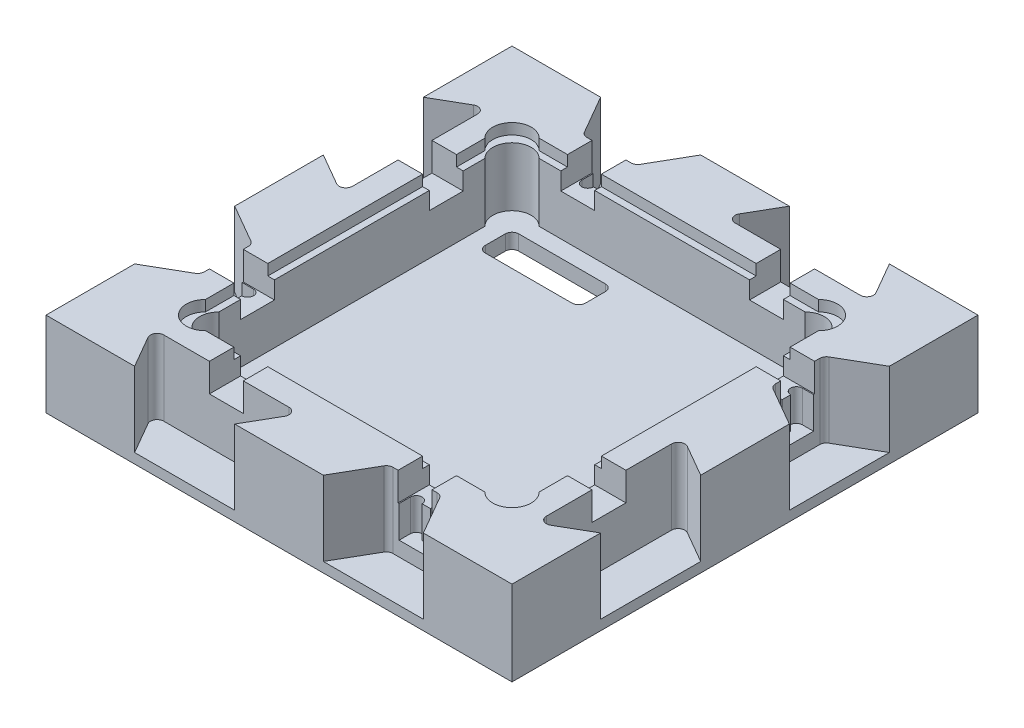
from build123d import *

# Parameters (mm, degrees)
SKETCH1_W                          = 139.7
SKETCH1_H                          = 139.7
BOSS_EXTRUDE1_DEPTH                = 12.7
POWER_SUPPLY_COMPONENT_DEPTH_DEPTH = 20.9
CUT_EXTRUDE6_DEPTH                 = 22.4
SKETCH8_W                          = 10.16
SKETCH8_H                          = 9.35
CUT_EXTRUDE7_DEPTH                 = 8.48
CUT_EXTRUDE8_DEPTH                 = 9.53
FILLET2_R                          = 2
CIRPATTERN5_COUNT                  = 4
FILLET2_OF_CIRPATTERN5_R           = 2
CUT_EXTRUDE9_DEPTH                 = 3.25
SKETCH12_W                         = 30
SKETCH12_H                         = 10
CUT_EXTRUDE10_DEPTH                = 101.969574625
FILLET5_R                          = 2
CIRPATTERN6_COUNT                  = 2
FILLET5_OF_CIRPATTERN6_R           = 2


with BuildPart() as part:
    # Sketch1 → Boss-Extrude1 (new, symmetric)
    with BuildSketch(Plane(origin=(0, 0, 0), x_dir=(1, 0, 0), z_dir=(0, 1, 0))):
        Rectangle(SKETCH1_W, SKETCH1_H)
    extrude(amount=BOSS_EXTRUDE1_DEPTH, both=True)

    # Sketch6 → power_supply_component_depth (cut)
    with BuildSketch(Plane(origin=(0, 12.7, 0), x_dir=(1, 0, 0), z_dir=(0, 1, 0))):
        with BuildLine():
            Line((-48, 39.868272016), (-48, -39.868272016))
            ThreePointArc((-48, -39.868272016), (-48, -48), (-39.868272016, -48))
            Line((-39.868272016, -48), (39.868272016, -48))
            ThreePointArc((39.868272016, -48), (48, -48), (48, -39.868272016))
            Line((48, -39.868272016), (48, 39.868272016))
            ThreePointArc((48, 39.868272016), (48, 48), (39.868272016, 48))
            Line((39.868272016, 48), (-39.868272016, 48))
            ThreePointArc((-39.868272016, 48), (-48, 48), (-48, 39.868272016))
        make_face()
    extrude(amount=-POWER_SUPPLY_COMPONENT_DEPTH_DEPTH, mode=Mode.SUBTRACT)

    # Sketch4 → Cut-Extrude6 (cut)
    with BuildSketch(Plane(origin=(0, 12.7, 0), x_dir=(1, 0, 0), z_dir=(0, 1, 0))):
        Polygon((-43.283333333, -69.85), (-50.500211698, -57.35), (-6.066454968, -57.35), (-13.283333333, -69.85), align=None)
        Polygon((43.283333333, -69.85), (36.066454968, -57.35), (20.500211698, -57.35), (13.283333333, -69.85), align=None)
    cut_extrude6 = extrude(amount=-CUT_EXTRUDE6_DEPTH, mode=Mode.SUBTRACT)

    # Sketch8 → Cut-Extrude7 (cut)
    with BuildSketch(Plane(origin=(0, 12.7, 0), x_dir=(1, 0, 0), z_dir=(0, 1, 0))):
        with Locations((-28.283333333, -52.675)):
            Rectangle(SKETCH8_W, SKETCH8_H)
        with Locations((28.283333333, -52.675)):
            Rectangle(SKETCH8_W, SKETCH8_H)
    cut_extrude7 = extrude(amount=-CUT_EXTRUDE7_DEPTH, mode=Mode.SUBTRACT)

    # Sketch9 → Cut-Extrude8 (cut)
    with BuildSketch(Plane(origin=(0, 4.22, 0), x_dir=(1, 0, 0), z_dir=(0, 1, 0))):
        with BuildLine():
            Line((27.018333333, -53.975), (29.548333333, -53.975))
            ThreePointArc((29.548333333, -53.975), (31.298333333, -52.225), (33.048333333, -53.975))
            Line((33.048333333, -53.975), (33.048333333, -57.35))
            Line((33.048333333, -57.35), (23.518333333, -57.35))
            Line((23.518333333, -57.35), (23.518333333, -53.975))
            ThreePointArc((23.518333333, -53.975), (25.268333333, -52.225), (27.018333333, -53.975))
        make_face()
    cut_extrude8 = extrude(amount=-CUT_EXTRUDE8_DEPTH, mode=Mode.SUBTRACT)

    # Fillet2
    fillet2_edges = [part.edges().sort_by_distance(p)[0] for p in [
        (-6.066454968, 1.5, 57.35),
        (-50.500211698, 1.5, 57.35),
        (36.066454968, 1.5, 57.35),
        (20.500211698, 1.5, 57.35),
    ]]
    fillet(fillet2_edges, radius=FILLET2_R)

    # CirPattern5: Cut-Extrude6, Cut-Extrude7, Cut-Extrude8 ×4 about axis
    cirpattern5_axis = Axis((0, 0, 0), (0, 1, 0))
    add([cut_extrude6.rotate(cirpattern5_axis, i * 360 / CIRPATTERN5_COUNT) for i in range(1, CIRPATTERN5_COUNT)], mode=Mode.SUBTRACT)
    add([cut_extrude7.rotate(cirpattern5_axis, i * 360 / CIRPATTERN5_COUNT) for i in range(1, CIRPATTERN5_COUNT)], mode=Mode.SUBTRACT)
    add([cut_extrude8.rotate(cirpattern5_axis, i * 360 / CIRPATTERN5_COUNT) for i in range(1, CIRPATTERN5_COUNT)], mode=Mode.SUBTRACT)

    # Fillet2 of CirPattern5
    fillet2_of_cirpattern5_edges = [part.edges().sort_by_distance(p)[0] for p in [
        (57.35, 1.5, 6.066454968),
        (57.35, 1.5, 50.500211698),
        (57.35, 1.5, -36.066454968),
        (57.35, 1.5, -20.500211698),
        (6.066454968, 1.5, -57.35),
        (50.500211698, 1.5, -57.35),
        (-36.066454968, 1.5, -57.35),
        (-20.500211698, 1.5, -57.35),
        (-57.35, 1.5, -6.066454968),
        (-57.35, 1.5, -50.500211698),
        (-57.35, 1.5, 36.066454968),
        (-57.35, 1.5, 20.500211698),
    ]]
    fillet(fillet2_of_cirpattern5_edges, radius=FILLET2_OF_CIRPATTERN5_R)

    # Sketch10 → Cut-Extrude9 (cut)
    with BuildSketch(Plane(origin=(0, 12.7, 0), x_dir=(1, 0, 0), z_dir=(0, 1, 0))):
        with BuildLine():
            Line((-41.868272016, 50), (41.868272016, 50))
            ThreePointArc((41.868272016, 50), (50, 50), (50, 41.868272016))
            Line((50, 41.868272016), (50, -41.868272016))
            ThreePointArc((50, -41.868272016), (50, -50), (41.868272016, -50))
            Line((41.868272016, -50), (-41.868272016, -50))
            ThreePointArc((-41.868272016, -50), (-50, -50), (-50, -41.868272016))
            Line((-50, -41.868272016), (-50, 41.868272016))
            ThreePointArc((-50, 41.868272016), (-50, 50), (-41.868272016, 50))
        make_face()
    extrude(amount=-CUT_EXTRUDE9_DEPTH, mode=Mode.SUBTRACT)

    # Sketch12 → Cut-Extrude10 (cut, symmetric)
    with BuildSketch(Plane(origin=(0, -8.2, 0), x_dir=(1, 0, 0), z_dir=(0, 1, 0))):
        with Locations((-28, 38)):
            Rectangle(SKETCH12_W, SKETCH12_H)
    cut_extrude10 = extrude(amount=CUT_EXTRUDE10_DEPTH, both=True, mode=Mode.SUBTRACT)

    # Fillet5
    fillet5_edges = [part.edges().sort_by_distance(p)[0] for p in [
        (-43, -10.45, -33),
        (-43, -10.45, -43),
        (-13, -10.45, -43),
        (-13, -10.45, -33),
    ]]
    fillet(fillet5_edges, radius=FILLET5_R)

    # CirPattern6: Cut-Extrude10 ×2 about axis
    cirpattern6_axis = Axis((0, 0, 0), (0, 1, 0))
    for i in range(1, CIRPATTERN6_COUNT):
        add(cut_extrude10.rotate(cirpattern6_axis, i * 360 / CIRPATTERN6_COUNT), mode=Mode.SUBTRACT)

    # Fillet5 of CirPattern6
    fillet5_of_cirpattern6_edges = [part.edges().sort_by_distance(p)[0] for p in [
        (43, -10.45, 33),
        (43, -10.45, 43),
        (13, -10.45, 43),
        (13, -10.45, 33),
    ]]
    fillet(fillet5_of_cirpattern6_edges, radius=FILLET5_OF_CIRPATTERN6_R)


solid = part.part
